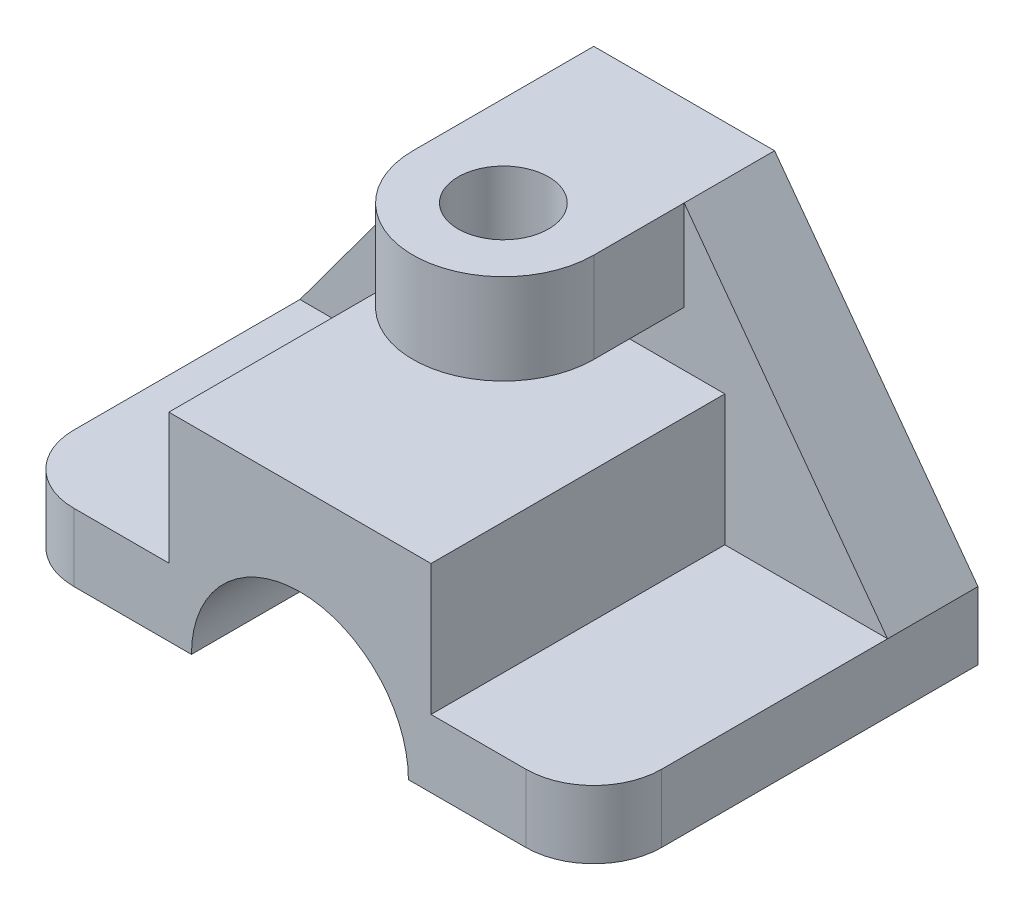
from build123d import *

# Parameters (mm, degrees)
EXTRUDE_1_DEPTH          = 85
CUT_EXTRUDE_1_DEPTH      = 116.666660236
CUT_EXTRUDE_1_DEPTH_BACK = 116.666660236
EXTRUDE_2_DEPTH          = 20
SKETCH_5_R               = 10
EXTRUDE_3_DEPTH          = 20
FILLET_1_R               = 15


with BuildPart() as part:
    # 스케치1 → 보스-돌출1 (new body)
    with BuildSketch(Plane.XY):
        Polygon((-65, 0), (65, 0), (65, 15), (29, 15), (29, 43.917835671), (-29, 43.917835671), (-29, 15), (-65, 15), align=None)
    extrude(amount=EXTRUDE_1_DEPTH)

    # 스케치2 → 컷-돌출1 (cut, two sides: drawn at the far end of the back side and taken through both)
    with BuildSketch(Plane.XY.offset(85).offset(-CUT_EXTRUDE_1_DEPTH_BACK)):
        with BuildLine():
            ThreePointArc((24, 0), (0, 24), (-24, 0))
            Line((-24, 0), (24, 0))
        make_face()
    extrude(amount=CUT_EXTRUDE_1_DEPTH + CUT_EXTRUDE_1_DEPTH_BACK, mode=Mode.SUBTRACT)

    # 스케치4 → 보스-돌출2 (add)
    with BuildSketch(Plane(origin=(0, 0, 0), x_dir=(-1, 0, 0), z_dir=(0, 0, -1))):
        Polygon((-65, 15), (-20, 76), (20, 76), (65, 15), (29, 15), (29, 43.917835671), (-29, 43.917835671), (-29, 15), align=None)
    extrude(amount=-EXTRUDE_2_DEPTH)

    # 스케치5 → 보스-돌출3 (add)
    with BuildSketch(Plane(origin=(0, 76, 0), x_dir=(1, 0, 0), z_dir=(0, 1, 0))):
        with BuildLine():
            Line((-20, 0), (-20, -40))
            ThreePointArc((-20, -40), (0, -60), (20, -40))
            Line((20, -40), (20, 0))
            Line((20, 0), (-20, 0))
        make_face()
        with Locations(Location((0, -40, 0), (0, 0, 270))):
            Circle(SKETCH_5_R, mode=Mode.SUBTRACT)
    extrude(amount=-EXTRUDE_3_DEPTH)

    # 필렛1
    fillet_1_edges = [part.edges().sort_by_distance(p)[0] for p in [
        (65, 7.5, 85),
        (-65, 7.5, 85),
    ]]
    fillet(fillet_1_edges, radius=FILLET_1_R)


solid = part.part
